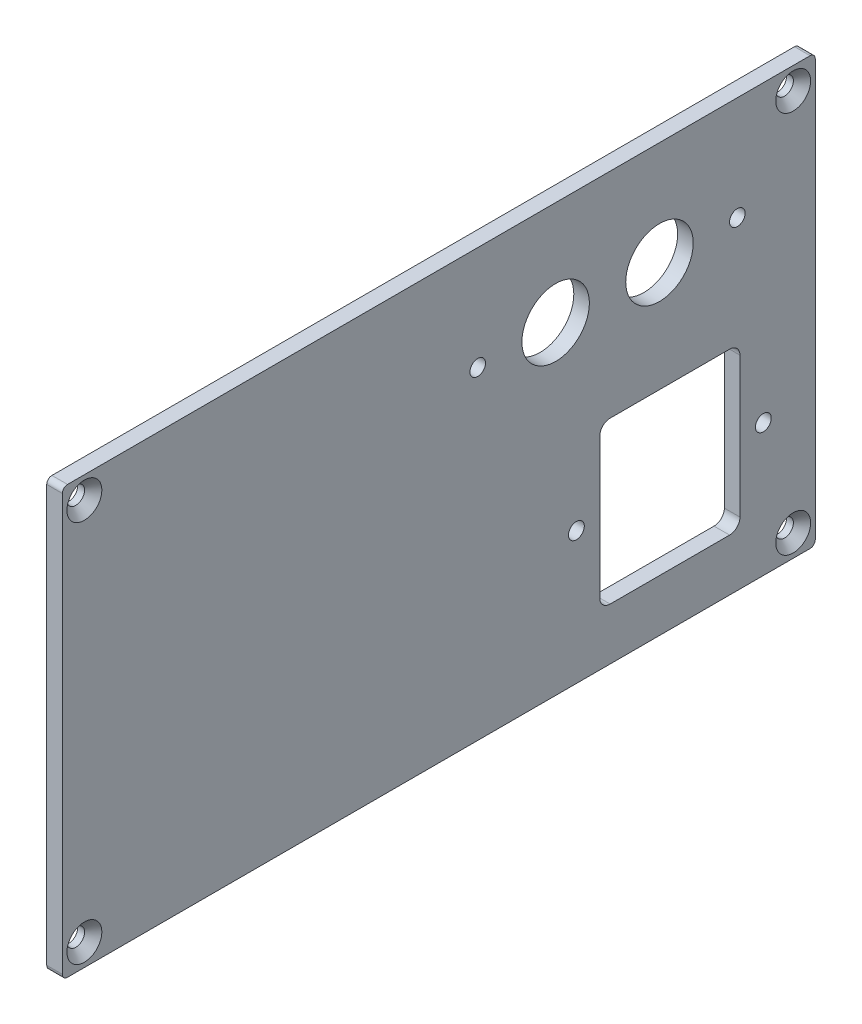
from build123d import *

# Parameters (mm, degrees)
SKETCH1_R                    = 1.525
SKETCH1_R_2                  = 6.5
SKETCH1_R_3                  = 1.5
BOSS_EXTRUDE1_DEPTH          = 3
CSK_FOR_M3_SFHCS1_AT_2_COUNT = 2
CSK_FOR_M3_SFHCS1_AT_2_PITCH = 136.5
CSK_FOR_M3_SFHCS1_AT_3_COUNT = 2
CSK_FOR_M3_SFHCS1_AT_3_PITCH = 155.125562046
CSK_FOR_M3_SFHCS1_AT_4_COUNT = 2
CSK_FOR_M3_SFHCS1_AT_4_PITCH = 73.7


with BuildPart() as part:
    # Sketch1 → Boss-Extrude1 (new body)
    with BuildSketch(Plane(origin=(0, 0, 0), x_dir=(0, 0, -1), z_dir=(1, 0, 0))):
        with BuildLine():
            Line((-71.5, 41.1), (71.5, 41.1))
            ThreePointArc((71.5, 41.1), (72.207106781, 40.807106781), (72.5, 40.1))
            Line((72.5, 40.1), (72.5, -40.1))
            ThreePointArc((72.5, -40.1), (72.207106781, -40.807106781), (71.5, -41.1))
            Line((71.5, -41.1), (-71.5, -41.1))
            ThreePointArc((-71.5, -41.1), (-72.207106781, -40.807106781), (-72.5, -40.1))
            Line((-72.5, -40.1), (-72.5, 40.1))
            ThreePointArc((-72.5, 40.1), (-72.207106781, 40.807106781), (-71.5, 41.1))
        make_face()
        with Locations((26.5, -15.6)):
            Circle(SKETCH1_R, mode=Mode.SUBTRACT)
        with Locations(Location((62.5, -15.6, 0), (0, 0, 180))):
            Circle(SKETCH1_R, mode=Mode.SUBTRACT)
        with Locations((22.5, 21.1)):
            Circle(SKETCH1_R_2, mode=Mode.SUBTRACT)
        with Locations((7.5, 21.1)):
            Circle(SKETCH1_R_3, mode=Mode.SUBTRACT)
        with Locations(Location((57.5, 21.1, 0), (0, 0, 180))):
            Circle(SKETCH1_R_3, mode=Mode.SUBTRACT)
        with Locations(Location((42.5, 21.1, 0), (0, 0, 180))):
            Circle(SKETCH1_R_2, mode=Mode.SUBTRACT)
        with BuildLine():
            Line((33, -0.1), (56, -0.1))
            ThreePointArc((56, -0.1), (57.414213562, -0.685786438), (58, -2.1))
            Line((58, -2.1), (58, -29.1))
            ThreePointArc((58, -29.1), (57.414213562, -30.514213562), (56, -31.1))
            Line((56, -31.1), (33, -31.1))
            ThreePointArc((33, -31.1), (31.585786438, -30.514213562), (31, -29.1))
            Line((31, -29.1), (31, -2.1))
            ThreePointArc((31, -2.1), (31.585786438, -0.685786438), (33, -0.1))
        make_face(mode=Mode.SUBTRACT)
    extrude(amount=BOSS_EXTRUDE1_DEPTH)

    # Sketch3 → CSK for M3 SFHCS1 (revolve, cut)
    with BuildSketch(Plane(origin=(3, 36.85, 68.25), x_dir=(0, 0, -1), z_dir=(0, 1, 0))):
        Polygon((0, 0), (0, 3), (1.7, 3), (1.7, 1.66), (3.36, 0), align=None)
    csk_for_m3_sfhcs1 = revolve(axis=Axis((9.35, 36.85, 68.25), (-1, 0, 0)), mode=Mode.SUBTRACT)

    # CSK for M3 SFHCS1 at 2: CSK for M3 SFHCS1 ×2
    with Locations(*[(0, 0, -i * CSK_FOR_M3_SFHCS1_AT_2_PITCH) for i in range(1, CSK_FOR_M3_SFHCS1_AT_2_COUNT)]):
        add(csk_for_m3_sfhcs1, mode=Mode.SUBTRACT)

    # CSK for M3 SFHCS1 at 3: CSK for M3 SFHCS1 ×2
    with Locations(*[Vector(0, -0.4750990038526292, -0.8799323477053447) * (i * CSK_FOR_M3_SFHCS1_AT_3_PITCH) for i in range(1, CSK_FOR_M3_SFHCS1_AT_3_COUNT)]):
        add(csk_for_m3_sfhcs1, mode=Mode.SUBTRACT)

    # CSK for M3 SFHCS1 at 4: CSK for M3 SFHCS1 ×2
    with Locations(*[(0, -i * CSK_FOR_M3_SFHCS1_AT_4_PITCH, 0) for i in range(1, CSK_FOR_M3_SFHCS1_AT_4_COUNT)]):
        add(csk_for_m3_sfhcs1, mode=Mode.SUBTRACT)


solid = part.part
